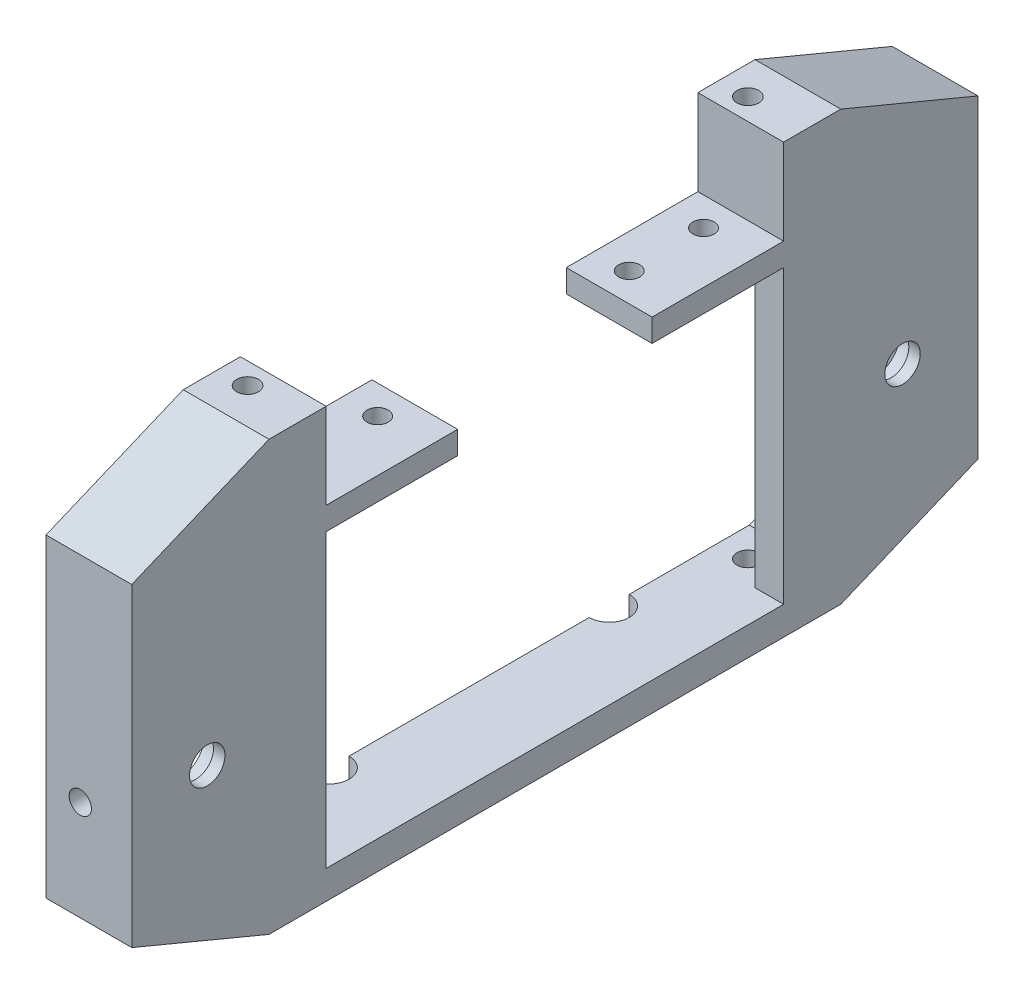
from build123d import *

# Parameters (mm, degrees)
SKETCH1_W           = 15
SKETCH1_H           = 34
BOSS_EXTRUDE1_DEPTH = 75
CUT_EXTRUDE5_DEPTH  = 15
CUT_EXTRUDE6_START  = -15
CUT_EXTRUDE6_DEPTH  = 10
SKETCH13_W          = 23
SKETCH13_H          = 4
BOSS_EXTRUDE4_DEPTH = 15
SKETCH14_R          = 1.85
CUT_EXTRUDE8_DEPTH  = 85.107074613
SKETCH15_W          = 9
SKETCH15_H          = 14
BOSS_EXTRUDE5_DEPTH = 10
CUT_EXTRUDE4_REACH  = 97.389
SKETCH5_R           = 1.9
SKETCH11_R          = 4.6
CUT_EXTRUDE7_DEPTH  = 10
SKETCH12_R          = 4.6
SKETCH12_R_2        = 3.1
BOSS_EXTRUDE3_DEPTH = 2
SKETCH20_W          = 40
SKETCH20_H          = 5
BOSS_EXTRUDE8_DEPTH = 15
SKETCH21_R          = 3.5
CUT_EXTRUDE11_DEPTH = 103.961157725
SKETCH22_R          = 1.95
CUT_EXTRUDE12_DEPTH = 167.595318061


with BuildPart() as part:
    # Sketch1 → Boss-Extrude1 (new body)
    with BuildSketch(Plane(origin=(0, 0, 0), x_dir=(1, 0, 0), z_dir=(0, 1, 0))):
        with Locations((7.5, 17)):
            Rectangle(SKETCH1_W, SKETCH1_H)
    extrude(amount=BOSS_EXTRUDE1_DEPTH)

    # Sketch2 → Cut-Extrude5 (cut)
    with BuildSketch(Plane(origin=(15, 0, 0), x_dir=(0, 0, -1), z_dir=(1, 0, 0))):
        Polygon((0, 75), (0, 65), (24, 75), align=None)
        Polygon((0, 0), (24, 0), (0, 10), align=None)
    extrude(amount=-CUT_EXTRUDE5_DEPTH, mode=Mode.SUBTRACT)

    # Sketch2<5> → Cut-Extrude6 (cut)
    with BuildSketch(Plane(origin=(15, 0, 0), x_dir=(0, 0, -1), z_dir=(1, 0, 0)).offset(CUT_EXTRUDE6_START)):
        Polygon((25, 5), (34, 5), (34, 70), (25, 70), (5, 61.666666667), (5, 13.333333333), align=None)
    extrude(amount=CUT_EXTRUDE6_DEPTH, mode=Mode.SUBTRACT)

    # Sketch13 → Boss-Extrude4 (add)
    with BuildSketch(Plane(origin=(15, 0, 0), x_dir=(0, 0, -1), z_dir=(1, 0, 0))):
        with Locations((45.5, 58)):
            Rectangle(SKETCH13_W, SKETCH13_H)
    extrude(amount=-BOSS_EXTRUDE4_DEPTH)

    # Sketch14 → Cut-Extrude8 (cut, through all)
    with BuildSketch(Plane(origin=(0, 60, 0), x_dir=(1, 0, 0), z_dir=(0, 1, 0))):
        with Locations(Location((6, 39, 0), (0, 0, 270))):
            Circle(SKETCH14_R)
        with Locations(Location((6, 52, 0), (0, 0, 270))):
            Circle(SKETCH14_R)
    extrude(amount=-CUT_EXTRUDE8_DEPTH, mode=Mode.SUBTRACT)

    # Sketch15 → Boss-Extrude5 (add)
    with BuildSketch(Plane.ZY.offset(-10)):
        with Locations((-29.5, 63)):
            Rectangle(SKETCH15_W, SKETCH15_H)
    extrude(amount=BOSS_EXTRUDE5_DEPTH)

    # Cut-Extrude4: up to this face of the body (flat: up to its plane)
    cut_extrude4_end = Plane(part.part.faces().sort_by_distance((7.5, 0, -29))[0])
    # Sketch5 → Cut-Extrude4 (cut, up to the picked face)
    with BuildSketch(Plane(origin=(0, 75, 0), x_dir=(1, 0, 0), z_dir=(0, 1, 0)), mode=Mode.PRIVATE) as cut_extrude4_sk1:
        with Locations(Location((5, 30.25, 0), (0, 0, 270))):
            Circle(SKETCH5_R)
    cut_extrude4_tool1 = split(extrude(cut_extrude4_sk1.sketch, amount=-CUT_EXTRUDE4_REACH, mode=Mode.PRIVATE), bisect_by=cut_extrude4_end, keep=Keep.BOTH, mode=Mode.PRIVATE)
    add(cut_extrude4_tool1.solids().sort_by(Axis((5, 75, -30.25), (0, -1, 0)))[0], mode=Mode.SUBTRACT)

    # Sketch11 → Cut-Extrude7 (cut)
    with BuildSketch(Plane(origin=(15, 0, 0), x_dir=(0, 0, -1), z_dir=(1, 0, 0))):
        with Locations((13.2, 31)):
            Circle(SKETCH11_R)
    extrude(amount=-CUT_EXTRUDE7_DEPTH, mode=Mode.SUBTRACT)

    # Sketch12 → Boss-Extrude3 (add)
    with BuildSketch(Plane(origin=(15, 0, 0), x_dir=(0, 0, -1), z_dir=(1, 0, 0))):
        with Locations((13.2, 31)):
            Circle(SKETCH12_R)
        with Locations((13.2, 31)):
            Circle(SKETCH12_R_2, mode=Mode.SUBTRACT)
    extrude(amount=-BOSS_EXTRUDE3_DEPTH)

    # Sketch20 → Boss-Extrude8 (add)
    with BuildSketch(Plane.ZY):
        with Locations((-54, 2.5)):
            Rectangle(SKETCH20_W, SKETCH20_H)
    extrude(amount=-BOSS_EXTRUDE8_DEPTH)

    # Sketch21 → Cut-Extrude11 (cut, through all)
    with BuildSketch(Plane(origin=(0, 5, 0), x_dir=(1, 0, 0), z_dir=(0, 1, 0))):
        with Locations((0, 49.5)):
            Circle(SKETCH21_R)
    extrude(amount=-CUT_EXTRUDE11_DEPTH, mode=Mode.SUBTRACT)

    # Mirror3: part across plane


with BuildPart() as part_1:
    add(part.part)
    add(part.part.mirror(Plane(origin=(55.311288741, 0, -74), x_dir=(1, 0, 0), z_dir=(0, 0, -1))))

    # Sketch22 → Cut-Extrude12 (cut, through all)
    with BuildSketch(Plane.XY):
        with Locations((6, 27.5)):
            Circle(SKETCH22_R)
    extrude(amount=-CUT_EXTRUDE12_DEPTH, mode=Mode.SUBTRACT)


solid = part_1.part
